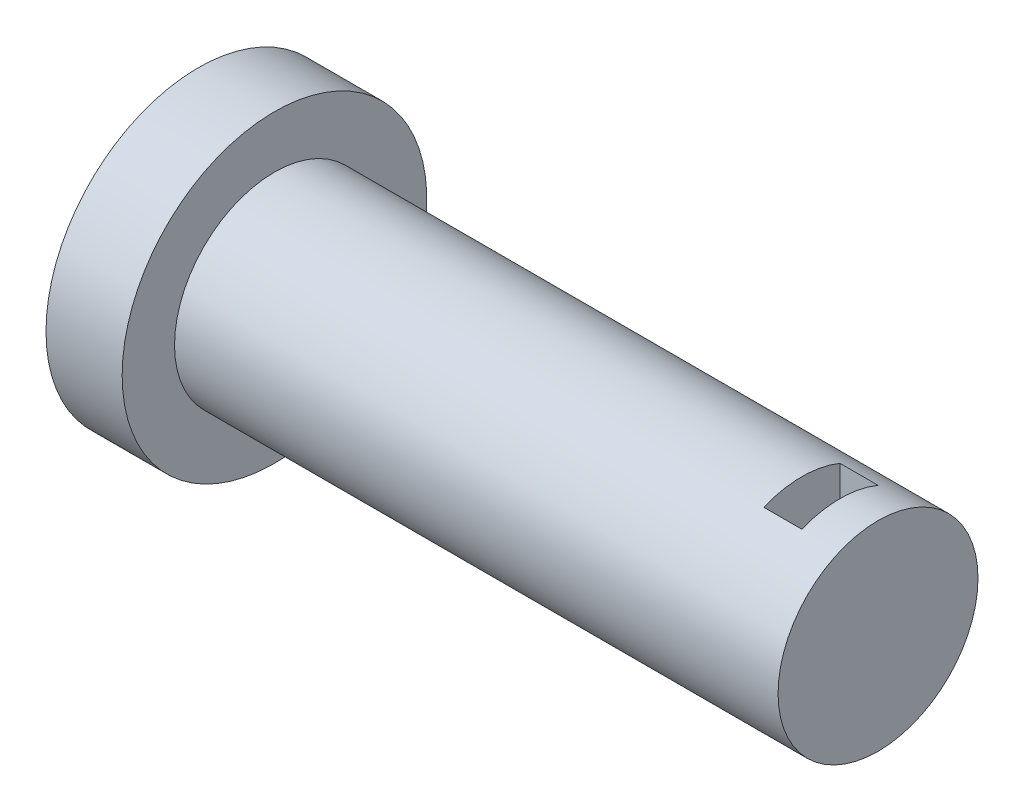
from build123d import *

# Parameters (mm, degrees)
SKETCH1_R               = 26.25
BOSS_EXTRUDE1_DEPTH     = 158.5
SKETCH2_R               = 40
BOSS_EXTRUDE2_DEPTH     = 20
CUT_EXTRUDE1_DEPTH      = 169.29215668
CUT_EXTRUDE1_DEPTH_BACK = 169.29215668
SKETCH3_W               = 10
SKETCH3_H               = 20


with BuildPart() as part:
    # Sketch1 → Boss-Extrude1 (new body)
    with BuildSketch(Plane(origin=(0, 0, 0), x_dir=(0, 0, -1), z_dir=(1, 0, 0))):
        Circle(SKETCH1_R)
    extrude(amount=BOSS_EXTRUDE1_DEPTH)

    # Sketch2 → Boss-Extrude2 (add)
    with BuildSketch(Plane.ZY):
        Circle(SKETCH2_R)
    extrude(amount=BOSS_EXTRUDE2_DEPTH)

    # Sketch3 → Cut-Extrude1 (cut, two sides: drawn at the far end of the back side and taken through both)
    with BuildSketch(Plane(origin=(0, 0, 0), x_dir=(1, 0, 0), z_dir=(0, 1, 0)).offset(-CUT_EXTRUDE1_DEPTH_BACK)):
        with Locations((143.5, 0)):
            Rectangle(SKETCH3_W, SKETCH3_H)
    extrude(amount=CUT_EXTRUDE1_DEPTH + CUT_EXTRUDE1_DEPTH_BACK, mode=Mode.SUBTRACT)


solid = part.part
